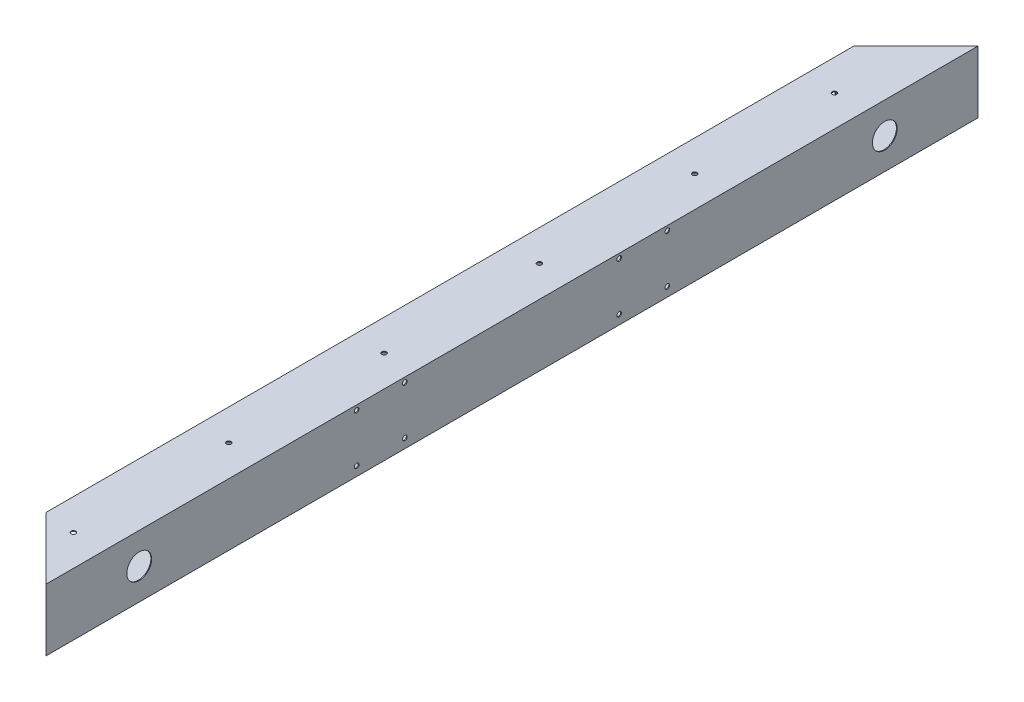
from build123d import *

# Parameters (mm, degrees)
CROQUIS1_W              = 40
CROQUIS1_H              = 40
CROQUIS1_W_2            = 39
CROQUIS1_H_2            = 39
SALIENTE_EXTRUIR2_DEPTH = 600
CORTAR_EXTRUIR2_DEPTH   = 600
CORTAR_EXTRUIR1_DEPTH   = 600
CROQUIS7_R              = 8
CORTAR_EXTRUIR3_DEPTH   = 550
CROQUIS8_R              = 8
CORTAR_EXTRUIR4_DEPTH   = 550
CROQUIS9_R              = 1.5
CORTAR_EXTRUIR5_DEPTH   = 550
CROQUIS10_R             = 1.5
CORTAR_EXTRUIR6_DEPTH   = 550


with BuildPart() as part:
    # Croquis1 → Saliente-Extruir2 (new body)
    with BuildSketch(Plane.XY):
        Rectangle(CROQUIS1_W, CROQUIS1_H)
        Rectangle(CROQUIS1_W_2, CROQUIS1_H_2, mode=Mode.SUBTRACT)
    extrude(amount=SALIENTE_EXTRUIR2_DEPTH)

    # Croquis6 → Cortar-Extruir2 (cut)
    with BuildSketch(Plane(origin=(0, 20, 0), x_dir=(1, 0, 0), z_dir=(0, 1, 0))):
        Polygon((20, -600), (-20, -560), (-20, -600), align=None)
    extrude(amount=-CORTAR_EXTRUIR2_DEPTH, mode=Mode.SUBTRACT)

    # Croquis5 → Cortar-Extruir1 (cut)
    with BuildSketch(Plane(origin=(0, 20, 0), x_dir=(1, 0, 0), z_dir=(0, 1, 0))):
        Polygon((20, 0), (-20, -40), (-20, 0), align=None)
    extrude(amount=-CORTAR_EXTRUIR1_DEPTH, mode=Mode.SUBTRACT)

    # Croquis7 → Cortar-Extruir3 (cut)
    with BuildSketch(Plane(origin=(20, 0, 0), x_dir=(0, 0, -1), z_dir=(1, 0, 0))):
        with Locations(Location((-540, 0, 0), (0, 0, 90))):
            Circle(CROQUIS7_R)
    extrude(amount=-CORTAR_EXTRUIR3_DEPTH, mode=Mode.SUBTRACT)

    # Croquis8 → Cortar-Extruir4 (cut)
    with BuildSketch(Plane(origin=(20, 0, 0), x_dir=(0, 0, -1), z_dir=(1, 0, 0))):
        with Locations(Location((-60, 0, 0), (0, 0, 90))):
            Circle(CROQUIS8_R)
    extrude(amount=-CORTAR_EXTRUIR4_DEPTH, mode=Mode.SUBTRACT)

    # Croquis9 → Cortar-Extruir5 (cut)
    with BuildSketch(Plane(origin=(0, 20, 0), x_dir=(1, 0, 0), z_dir=(0, 1, 0))):
        with Locations(Location((0, -562.380435737, 0), (0, 0, 270))):
            Circle(CROQUIS9_R)
        with Locations(Location((0, -462.380435737, 0), (0, 0, 270))):
            Circle(CROQUIS9_R)
        with Locations(Location((0, -362.380435737, 0), (0, 0, 270))):
            Circle(CROQUIS9_R)
        with Locations(Location((0, -262.380435737, 0), (0, 0, 270))):
            Circle(CROQUIS9_R)
        with Locations(Location((0, -162.380435737, 0), (0, 0, 270))):
            Circle(CROQUIS9_R)
        with Locations(Location((0, -72.380435737, 0), (0, 0, 270))):
            Circle(CROQUIS9_R)
    extrude(amount=-CORTAR_EXTRUIR5_DEPTH, mode=Mode.SUBTRACT)

    # Croquis10 → Cortar-Extruir6 (cut)
    with BuildSketch(Plane(origin=(20, 0, 0), x_dir=(0, 0, -1), z_dir=(1, 0, 0))):
        with Locations(Location((-200, 17, 0), (0, 0, 90))):
            Circle(CROQUIS10_R)
        with Locations(Location((-231, 17, 0), (0, 0, 90))):
            Circle(CROQUIS10_R)
        with Locations(Location((-200, -14, 0), (0, 0, 90))):
            Circle(CROQUIS10_R)
        with Locations(Location((-231, -14, 0), (0, 0, 90))):
            Circle(CROQUIS10_R)
        with Locations(Location((-369, 17, 0), (0, 0, 90))):
            Circle(CROQUIS10_R)
        with Locations(Location((-400, 17, 0), (0, 0, 90))):
            Circle(CROQUIS10_R)
        with Locations(Location((-369, -14, 0), (0, 0, 90))):
            Circle(CROQUIS10_R)
        with Locations(Location((-400, -14, 0), (0, 0, 90))):
            Circle(CROQUIS10_R)
    extrude(amount=-CORTAR_EXTRUIR6_DEPTH, mode=Mode.SUBTRACT)


solid = part.part
